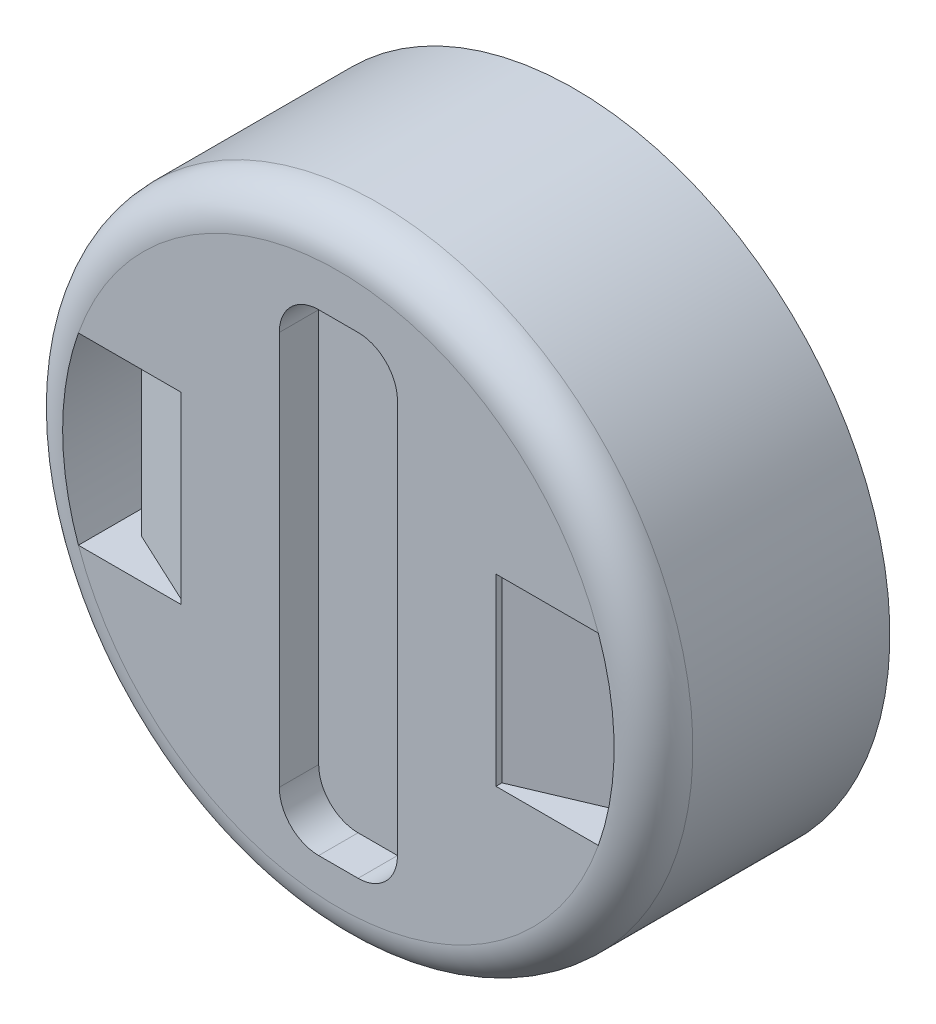
from build123d import *

# Parameters (mm, degrees)
SKETCH_1_R          = 8
EXTRUDE_1_DEPTH     = 6
FILLET_1_R          = 1
SKETCH_3_W          = 3
SKETCH_3_H          = 12
CUT_EXTRUDE_1_DEPTH = 1
FILLET_2_R          = 1
CUT_EXTRUDE_2_DEPTH = 1
CHAMFER_2_SIZE      = 2
CHAMFER_2_SIZE2     = 0.932615316
CHAMFER_5_SIZE      = 2
CHAMFER_5_SIZE2     = 0.848949632
CUT_EXTRUDE_3_DEPTH = 8
CUT_EXTRUDE_START   = -4
SKETCH_7_R          = 7
CUT_EXTRUDE_4_DEPTH = 4


with BuildPart() as part:
    # 草图1 → 凸台-拉伸1 (new body)
    with BuildSketch(Plane(origin=(0, 0, 12), x_dir=(-1, 0, 0), z_dir=(0, 0, -1))):
        Circle(SKETCH_1_R)
    extrude(amount=-EXTRUDE_1_DEPTH)

    # 圆角1
    fillet_1_edges = [part.edges().sort_by_distance(p)[0] for p in [
        (8, 0, 18),
    ]]
    fillet(fillet_1_edges, radius=FILLET_1_R)

    # 草图3 → 切除-拉伸1 (cut)
    with BuildSketch(Plane.XY.offset(18)):
        with Locations((0, -0.105406486)):
            Rectangle(SKETCH_3_W, SKETCH_3_H)
    extrude(amount=-CUT_EXTRUDE_1_DEPTH, mode=Mode.SUBTRACT)

    # 圆角2
    fillet_2_edges = [part.edges().sort_by_distance(p)[0] for p in [
        (-1.5, -6.105406486, 17.5),
        (-1.5, 5.894593514, 17.5),
        (1.5, 5.894593514, 17.5),
        (1.5, -6.105406486, 17.5),
    ]]
    fillet(fillet_2_edges, radius=FILLET_2_R)

    # 草图4 → 切除-拉伸2 (cut)
    with BuildSketch(Plane.XY.offset(18)):
        with BuildLine():
            Line((-6.599663291, 2.333333333), (-4, 2.333333333))
            Line((-4, 2.333333333), (-4, -2.333333333))
            Line((-4, -2.333333333), (-6.599663291, -2.333333333))
            ThreePointArc((-6.599663291, -2.333333333), (-7, 0), (-6.599663291, 2.333333333))
        make_face()
        with BuildLine():
            Line((4, -2.333333333), (6.599663291, -2.333333333))
            ThreePointArc((6.599663291, -2.333333333), (7, 0), (6.599663291, 2.333333333))
            Line((6.599663291, 2.333333333), (4, 2.333333333))
            Line((4, 2.333333333), (4, -2.333333333))
        make_face()
    extrude(amount=-CUT_EXTRUDE_2_DEPTH, mode=Mode.SUBTRACT)

    # 倒角2
    chamfer_2_edges = [part.edges().sort_by_distance(p)[0] for p in [
        (-4, 0, 17),
    ]]
    chamfer_2_side = [part.faces().sort_by_distance(p)[0] for p in [
        (-5.436521823, 0, 17),
    ]]
    chamfer(chamfer_2_edges, length=CHAMFER_2_SIZE, length2=CHAMFER_2_SIZE2, reference=chamfer_2_side[0])

    # 倒角5
    chamfer_5_edges = [part.edges().sort_by_distance(p)[0] for p in [
        (4, 0, 17),
    ]]
    chamfer_5_side = [part.faces().sort_by_distance(p)[0] for p in [
        (5.436521823, 0, 17),
    ]]
    chamfer(chamfer_5_edges, length=CHAMFER_5_SIZE, length2=CHAMFER_5_SIZE2, reference=chamfer_5_side[0])

    # 草图6 → 切除-拉伸3 (cut)
    with BuildSketch(Plane.XY.offset(17)):
        with BuildLine():
            Line((-6.599663291, -2.333333333), (-6, -2.333333333))
            Line((-6, -2.333333333), (-6, 2.333333333))
            Line((-6, 2.333333333), (-6.599663291, 2.333333333))
            ThreePointArc((-6.599663291, 2.333333333), (-7, 0), (-6.599663291, -2.333333333))
        make_face()
        with BuildLine():
            Line((6.599663291, 2.333333333), (6, 2.333333333))
            Line((6, 2.333333333), (6, -2.333333333))
            Line((6, -2.333333333), (6.599663291, -2.333333333))
            ThreePointArc((6.599663291, -2.333333333), (7, 0), (6.599663291, 2.333333333))
        make_face()
    extrude(amount=-CUT_EXTRUDE_3_DEPTH, mode=Mode.SUBTRACT)

    # 草图7 → 切除-拉伸4 (cut)
    with BuildSketch(Plane(origin=(0, 0, 12), x_dir=(-1, 0, 0), z_dir=(0, 0, -1)).offset(CUT_EXTRUDE_START)):
        Circle(SKETCH_7_R)
    extrude(amount=CUT_EXTRUDE_4_DEPTH, mode=Mode.SUBTRACT)


solid = part.part
